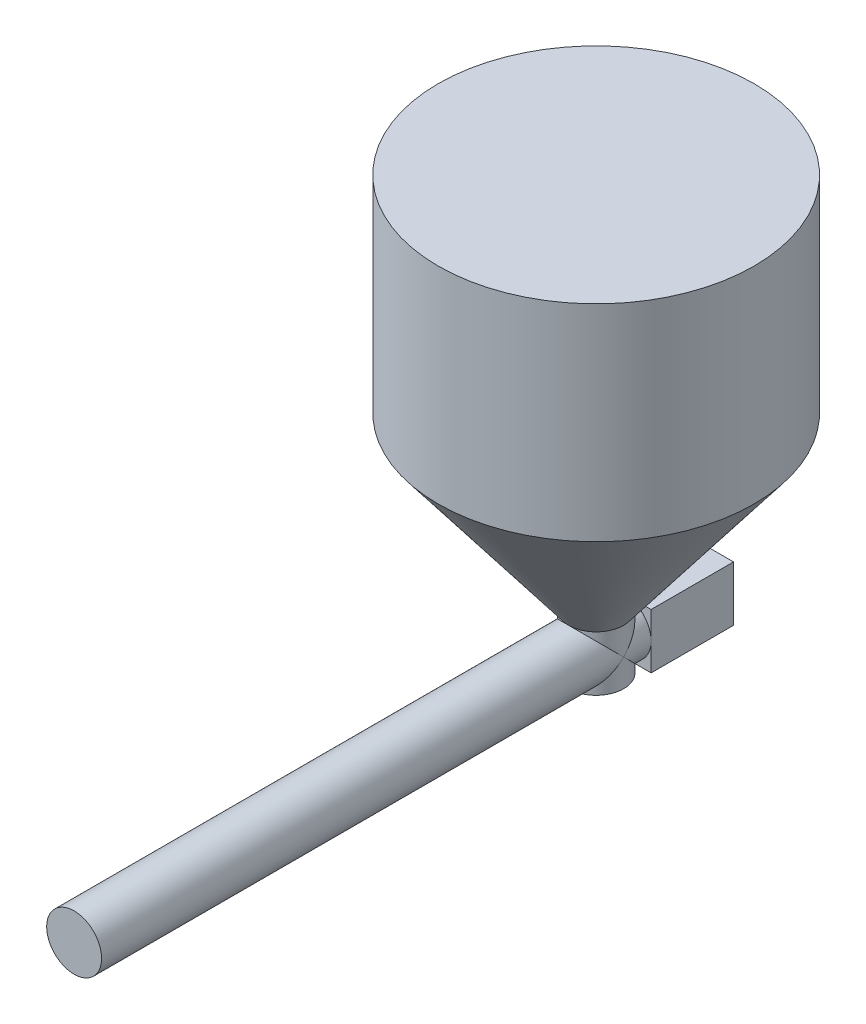
from build123d import *

# Parameters (mm, degrees)
CROQUIS1_R              = 115
SALIENTE_EXTRUIR1_DEPTH = 150
CROQUIS3_R              = 20
CROQUIS2_R              = 115
CROQUIS4_R              = 20
SALIENTE_EXTRUIR2_DEPTH = 40
CROQUIS5_R              = 20
SALIENTE_EXTRUIR3_DEPTH = 400
CROQUIS6_W              = 40
CROQUIS6_H              = 40
SALIENTE_EXTRUIR4_DEPTH = 60


with BuildPart() as part:
    # Croquis1 → Saliente-Extruir1 (new body)
    with BuildSketch(Plane(origin=(0, 0, 0), x_dir=(1, 0, 0), z_dir=(0, 1, 0))):
        with Locations(Location((0, 0, 0), (0, 0, 270))):
            Circle(CROQUIS1_R)
    extrude(amount=-SALIENTE_EXTRUIR1_DEPTH)

    # Croquis3 → Recubrir1 section 0
    with BuildSketch(Plane(origin=(0, -274, 0), x_dir=(1, 0, 0), z_dir=(0, 1, 0))):
        Circle(CROQUIS3_R)
    # Croquis2 → Recubrir1 section 1
    with BuildSketch(Plane.XZ.offset(150)):
        Circle(CROQUIS2_R)
    loft()

    # Croquis4 → Saliente-Extruir2 (add)
    with BuildSketch(Plane.XZ.offset(274)):
        with Locations(Location((0, 0, 0), (0, 0, 270))):
            Circle(CROQUIS4_R)
    extrude(amount=SALIENTE_EXTRUIR2_DEPTH)

    # Croquis5 → Saliente-Extruir3 (add)
    with BuildSketch(Plane(origin=(0, 0, -20), x_dir=(-1, 0, 0), z_dir=(0, 0, -1))):
        with Locations((0, -294)):
            Circle(CROQUIS5_R)
    extrude(amount=-SALIENTE_EXTRUIR3_DEPTH)

    # Croquis6 → Saliente-Extruir4 (add)
    with BuildSketch(Plane(origin=(0, 0, -20), x_dir=(-1, 0, 0), z_dir=(0, 0, -1))):
        with Locations((0, -294)):
            Rectangle(CROQUIS6_W, CROQUIS6_H)
    extrude(amount=SALIENTE_EXTRUIR4_DEPTH)


solid = part.part
